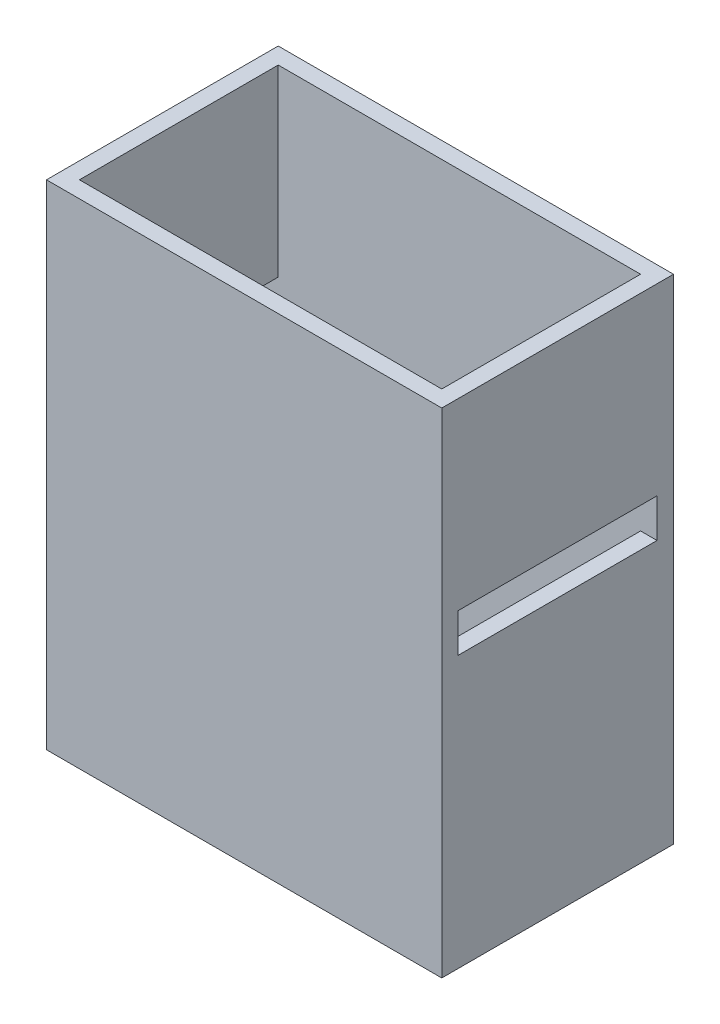
from build123d import *

# Parameters (mm, degrees)
SKETCH1_W               = 24
SKETCH1_H               = 14.07
BOSS_EXTRUDE1_DEPTH     = 29.97
SKETCH2_W               = 22
SKETCH2_H               = 12.07
CUT_EXTRUDE1_DEPTH      = 28.97
CUT_EXTRUDE2_DEPTH      = 41.892123936
CUT_EXTRUDE2_DEPTH_BACK = 41.892123936
SKETCH3_W               = 12.07
SKETCH3_H               = 2.35


with BuildPart() as part:
    # Sketch1 → Boss-Extrude1 (new body)
    with BuildSketch(Plane(origin=(0, 0, 0), x_dir=(1, 0, 0), z_dir=(0, 1, 0))):
        with Locations((12, 7.035)):
            Rectangle(SKETCH1_W, SKETCH1_H)
    extrude(amount=BOSS_EXTRUDE1_DEPTH)

    # Sketch2 → Cut-Extrude1 (cut)
    with BuildSketch(Plane(origin=(0, 29.97, 0), x_dir=(1, 0, 0), z_dir=(0, 1, 0))):
        with Locations((12, 7.035)):
            Rectangle(SKETCH2_W, SKETCH2_H)
    extrude(amount=-CUT_EXTRUDE1_DEPTH, mode=Mode.SUBTRACT)

    # Sketch3 → Cut-Extrude2 (cut, two sides: drawn at the far end of the back side and taken through both)
    with BuildSketch(Plane.ZY.offset(-CUT_EXTRUDE2_DEPTH_BACK)):
        with Locations((-7.035, 17.645)):
            Rectangle(SKETCH3_W, SKETCH3_H)
    extrude(amount=CUT_EXTRUDE2_DEPTH + CUT_EXTRUDE2_DEPTH_BACK, mode=Mode.SUBTRACT)


solid = part.part
